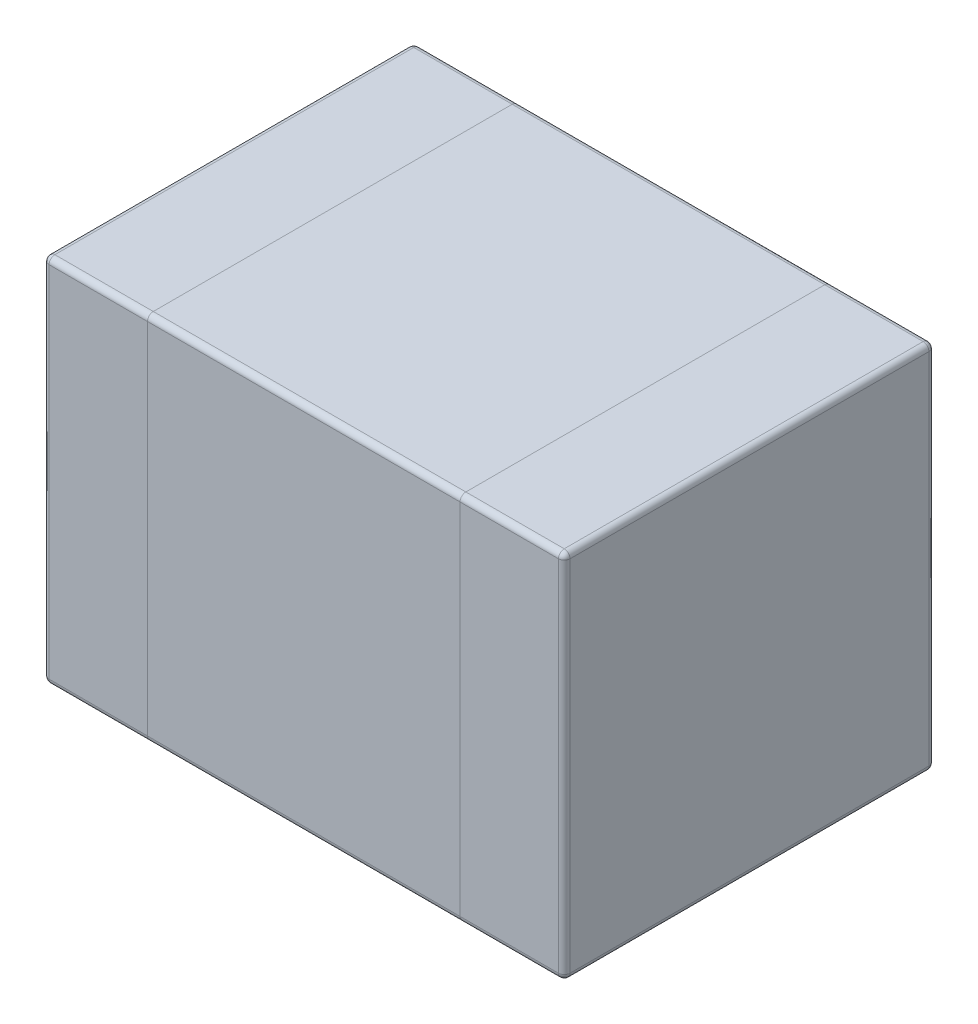
from build123d import *

# Parameters (mm, degrees)
SKETCH1_W      = 4.5
SKETCH1_H      = 3.2
EXTRUDE1_DEPTH = 3.2
FILLET1_R      = 0.05


with BuildPart() as part:
    # Sketch1 → Extrude1 (new body)
    with BuildSketch(Plane(origin=(0, 0, 0), x_dir=(1, 0, 0), z_dir=(0, 1, 0))):
        Rectangle(SKETCH1_W, SKETCH1_H)
    extrude(amount=EXTRUDE1_DEPTH)

    # Fillet1
    fillet1_edges = [part.edges().sort_by_distance(p)[0] for p in [
        (-2.25, 3.2, 0),
        (0, 3.2, 1.6),
        (2.25, 3.2, 0),
        (0, 0, 1.6),
        (-2.25, 0, 0),
        (0, 0, -1.6),
        (2.25, 0, 0),
        (0, 3.2, -1.6),
        (2.25, 1.6, 1.6),
        (-2.25, 1.6, 1.6),
        (-2.25, 1.6, -1.6),
        (2.25, 1.6, -1.6),
    ]]
    fillet(fillet1_edges, radius=FILLET1_R)


solid = part.part
